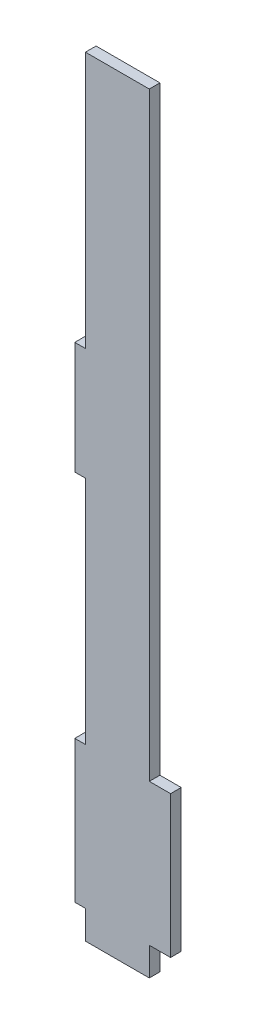
from build123d import *

# Parameters (mm, degrees)
SKETCH1_W           = 18
SKETCH1_H           = 61
BASE_SHAPE_DEPTH    = 3
SKETCH2_W           = 6
SKETCH2_H           = 40
SKETCH2_W_2         = 3
FINGERS_DEPTH       = 3
SKETCH3_W           = 18
SKETCH3_H           = 3
BOSS_EXTRUDE1_DEPTH = 156
SKETCH4_W           = 3
SKETCH4_H           = 31.66614885
BOSS_EXTRUDE3_DEPTH = 3


with BuildPart() as part:
    # Sketch1 → Base Shape (new body)
    with BuildSketch(Plane.XY):
        with Locations((-9, 30.5)):
            Rectangle(SKETCH1_W, SKETCH1_H)
    extrude(amount=BASE_SHAPE_DEPTH)

    # Sketch2 → Fingers (add)
    with BuildSketch(Plane.XY.offset(3)):
        with Locations((3, 28)):
            Rectangle(SKETCH2_W, SKETCH2_H)
        with Locations((-19.5, 28)):
            Rectangle(SKETCH2_W_2, SKETCH2_H)
    extrude(amount=-FINGERS_DEPTH)

    # Sketch3 → Boss-Extrude1 (add)
    with BuildSketch(Plane(origin=(0, 61, 0), x_dir=(1, 0, 0), z_dir=(0, 1, 0))):
        with Locations((-9, -1.5)):
            Rectangle(SKETCH3_W, SKETCH3_H)
    extrude(amount=BOSS_EXTRUDE1_DEPTH)

    # Sketch4 → Boss-Extrude3 (add, through all)
    with BuildSketch(Plane.XY.offset(3)):
        with Locations((-19.5, 128.833074425)):
            Rectangle(SKETCH4_W, SKETCH4_H)
    extrude(amount=-BOSS_EXTRUDE3_DEPTH)


solid = part.part
